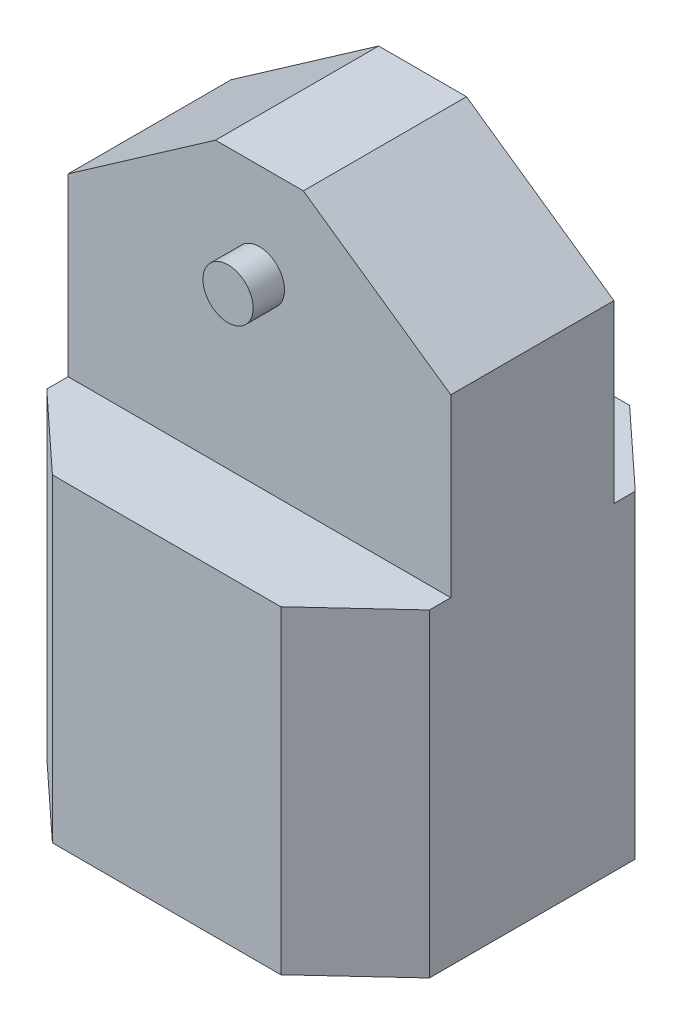
from build123d import *

# Parameters (mm, degrees)
EXTRUDE_1_DEPTH     = 476
SKETCH1_R           = 21
BOSS_EXTRUDE1_DEPTH = 50
SKETCH2_W           = 179.570161801
SKETCH2_H           = 266.735506726
CUT_EXTRUDE1_DEPTH  = 584.158549676
CUT_EXTRUDE2_DEPTH  = 541.087974739
SKETCH4_R           = 20
BOSS_EXTRUDE2_DEPTH = 90


with BuildPart() as part:
    # Эскиз1 → Вытянуть1 (new body)
    with BuildSketch(Plane(origin=(0, 0, 0), x_dir=(1, 0, 0), z_dir=(0, 1, 0))):
        Polygon((-151.693051502, 77.916478726), (-151.693051502, -86.083521274), (-90.193051502, -143.083521274), (91.806948498, -143.083521274), (153.306948498, -86.083521274), (153.306948498, 77.916478726), (91.806948498, 134.916478726), (-90.193051502, 134.916478726), align=None)
    extrude(amount=EXTRUDE_1_DEPTH)

    # Sketch2 → Cut-Extrude1 (cut, through all)
    with BuildSketch(Plane.ZY.offset(151.693051502)):
        with Locations((158.868602175, 387.367753363)):
            Rectangle(SKETCH2_W, SKETCH2_H)
        with Locations((-150.701559626, 387.367753363)):
            Rectangle(SKETCH2_W, SKETCH2_H)
    extrude(amount=-CUT_EXTRUDE1_DEPTH, mode=Mode.SUBTRACT)

    # Sketch3 → Cut-Extrude2 (cut, through all)
    with BuildSketch(Plane.XY.offset(69.083521274)):
        Polygon((-151.693051502, 394), (-34.193051502, 476), (-151.693051502, 476), align=None)
        Polygon((153.306948498, 476), (35.806948498, 476), (153.306948498, 394), align=None)
    extrude(amount=-CUT_EXTRUDE2_DEPTH, mode=Mode.SUBTRACT)

    # Sketch4 → Boss-Extrude2 (add, symmetric)
    with BuildSketch(Plane.XY.offset(4.083521274)):
        with Locations(Location((0.806948498, 400, 0), (0, 0, 180))):
            Circle(SKETCH4_R)
    extrude(amount=BOSS_EXTRUDE2_DEPTH, both=True)


with BuildPart() as body_2:
    # Sketch1 → Boss-Extrude1 (new body)
    with BuildSketch(Plane(origin=(0, 0, 0), x_dir=(-1, 0, 0), z_dir=(0, -1, 0))):
        with Locations(Location((-0.806948498, -4.083521274, 0), (0, 0, 90))):
            Circle(SKETCH1_R)
    extrude(amount=BOSS_EXTRUDE1_DEPTH)


solid = Compound([part.part, body_2.part])
